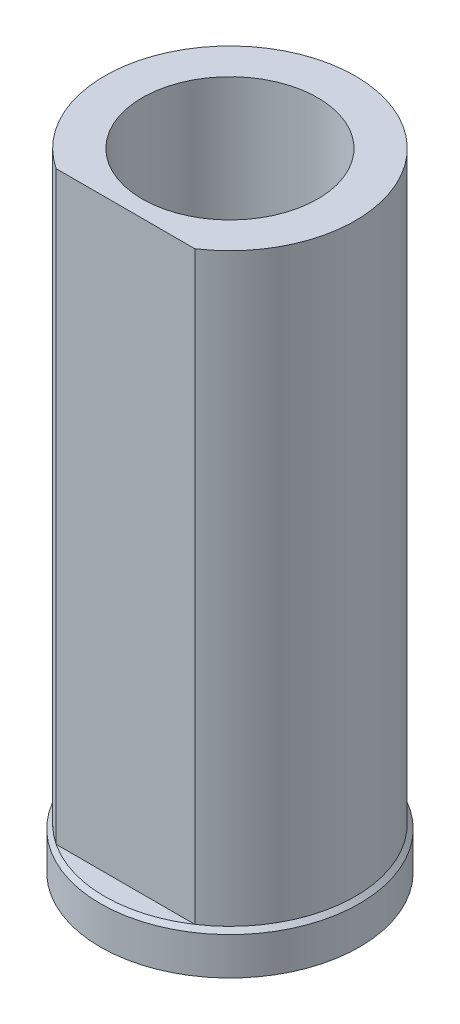
from build123d import *

# Parameters (mm, degrees)
CROQUIS1_R                 = 3.1
SALIENTE_EXTRUIR1_DEPTH    = 1
CROQUIS2_R                 = 3
SALIENTE_EXTRUIR2_DEPTH    = 14
CHAFL_N3_SIZE              = 0.1
CORTAR_EXTRUIR1_DEPTH      = 16.627539794
CORTAR_EXTRUIR1_DEPTH_BACK = 14
CROQUIS6_R                 = 2.1
CORTAR_EXTRUIR2_DEPTH      = 14


with BuildPart() as part:
    # Croquis1 → Saliente-Extruir1 (new body)
    with BuildSketch(Plane(origin=(0, 0, 0), x_dir=(1, 0, 0), z_dir=(0, 1, 0))):
        with Locations(Location((0, 0, 0), (0, 0, 270))):
            Circle(CROQUIS1_R)
    extrude(amount=SALIENTE_EXTRUIR1_DEPTH)

    # Chaflán3
    chafl_n3_edges = [part.edges().sort_by_distance(p)[0] for p in [
        (0, 1, -3.1),
    ]]
    chamfer(chafl_n3_edges, length=CHAFL_N3_SIZE)


with BuildPart() as body_2:
    # Croquis2 → Saliente-Extruir2 (new body)
    with BuildSketch(Plane(origin=(0, 1, 0), x_dir=(1, 0, 0), z_dir=(0, 1, 0))):
        with Locations(Location((0, 0, 0), (0, 0, 270))):
            Circle(CROQUIS2_R)
    extrude(amount=SALIENTE_EXTRUIR2_DEPTH)

    # Croquis5 → Cortar-Extruir1 (cut, two sides: drawn at the far end of the back side and taken through both)
    with BuildSketch(Plane(origin=(0, 15, 0), x_dir=(1, 0, 0), z_dir=(0, 1, 0)).offset(-CORTAR_EXTRUIR1_DEPTH_BACK)):
        with BuildLine():
            Line((1.658312395, -2.5), (-1.658312395, -2.5))
            ThreePointArc((-1.658312395, -2.5), (0, -3), (1.658312395, -2.5))
        make_face()
    extrude(amount=CORTAR_EXTRUIR1_DEPTH + CORTAR_EXTRUIR1_DEPTH_BACK, mode=Mode.SUBTRACT)

    # Croquis6 → Cortar-Extruir2 (cut)
    with BuildSketch(Plane(origin=(0, 15, 0), x_dir=(1, 0, 0), z_dir=(0, 1, 0))):
        with Locations(Location((0, 0, 0), (0, 0, 270))):
            Circle(CROQUIS6_R)
    extrude(amount=-CORTAR_EXTRUIR2_DEPTH, mode=Mode.SUBTRACT)


solid = Compound([part.part, body_2.part])
